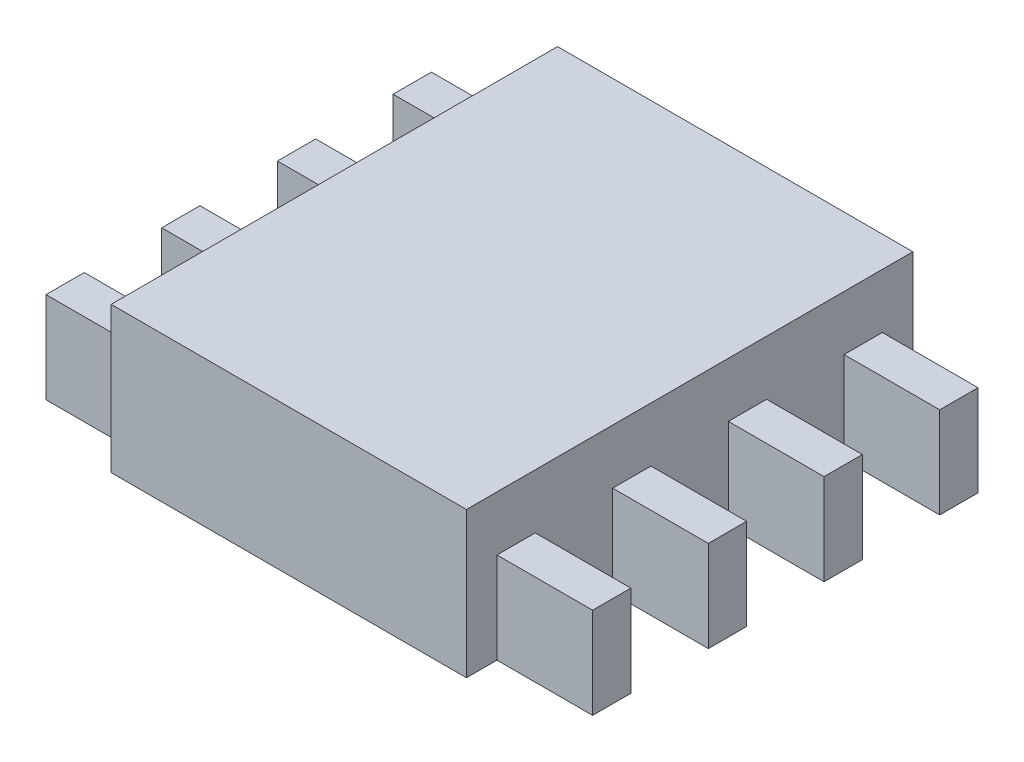
from build123d import *

# Parameters (mm, degrees)
SKETCH1_W      = 3.9
SKETCH1_H      = 4.9
EXTRUDE1_DEPTH = 1.6
SKETCH2_W      = 1.05
SKETCH2_H      = 0.42
EXTRUDE2_DEPTH = 1


with BuildPart() as part:
    # Sketch1 → Extrude1 (new body)
    with BuildSketch(Plane(origin=(0, 0, 0), x_dir=(1, 0, 0), z_dir=(0, 1, 0))):
        Rectangle(SKETCH1_W, SKETCH1_H)
    extrude(amount=EXTRUDE1_DEPTH)

    # Sketch2 → Extrude2 (add)
    with BuildSketch(Plane(origin=(0, 0, 0), x_dir=(1, 0, 0), z_dir=(0, 1, 0))):
        with Locations((-2.475, 1.905)):
            Rectangle(SKETCH2_W, SKETCH2_H)
        with Locations((-2.475, 0.635)):
            Rectangle(SKETCH2_W, SKETCH2_H)
        with Locations((-2.475, -0.635)):
            Rectangle(SKETCH2_W, SKETCH2_H)
        with Locations((-2.475, -1.905)):
            Rectangle(SKETCH2_W, SKETCH2_H)
        with Locations((2.475, -1.905)):
            Rectangle(SKETCH2_W, SKETCH2_H)
        with Locations((2.475, -0.635)):
            Rectangle(SKETCH2_W, SKETCH2_H)
        with Locations((2.475, 0.635)):
            Rectangle(SKETCH2_W, SKETCH2_H)
        with Locations((2.475, 1.905)):
            Rectangle(SKETCH2_W, SKETCH2_H)
    extrude(amount=EXTRUDE2_DEPTH)


solid = part.part
